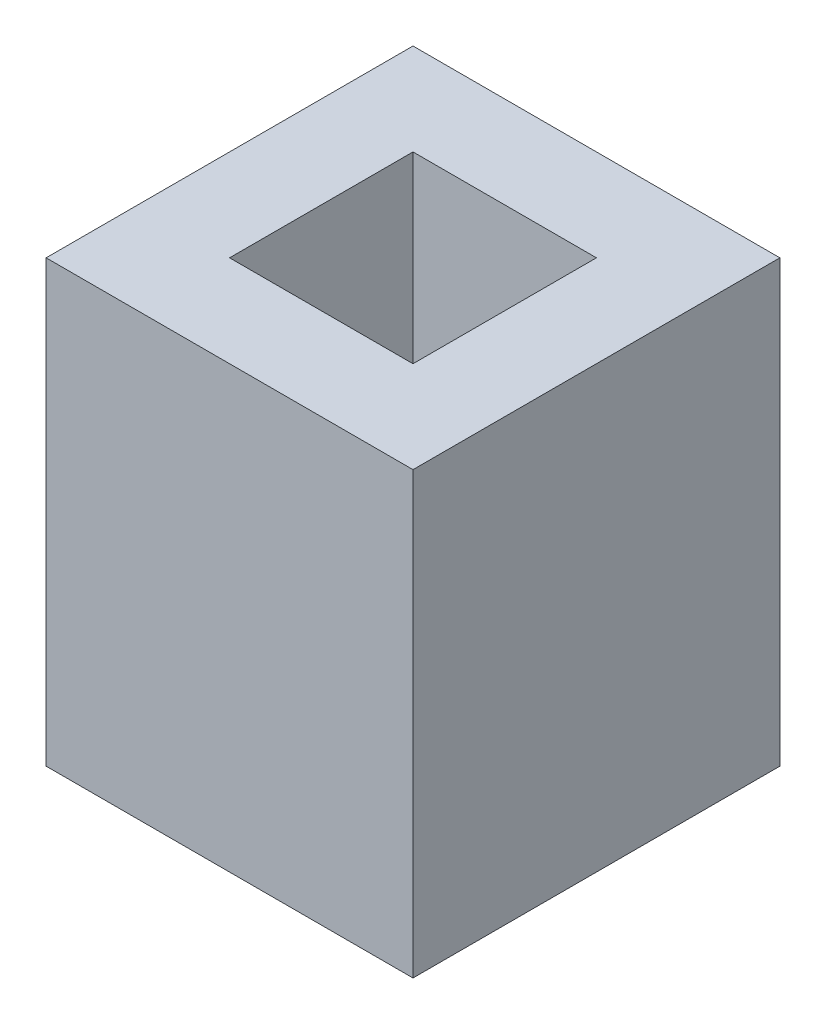
from build123d import *

# Parameters (mm, degrees)
SKETCH2_W           = 10
SKETCH2_H           = 10
SKETCH2_W_2         = 5
SKETCH2_H_2         = 5
BOSS_EXTRUDE1_DEPTH = 12


with BuildPart() as part:
    # Sketch2 → Boss-Extrude1 (new body)
    with BuildSketch(Plane(origin=(0, 0, 0), x_dir=(1, 0, 0), z_dir=(0, 1, 0))):
        with Locations((5, 5)):
            Rectangle(SKETCH2_W, SKETCH2_H)
        with Locations((5, 5)):
            Rectangle(SKETCH2_W_2, SKETCH2_H_2, mode=Mode.SUBTRACT)
    extrude(amount=BOSS_EXTRUDE1_DEPTH)


solid = part.part
